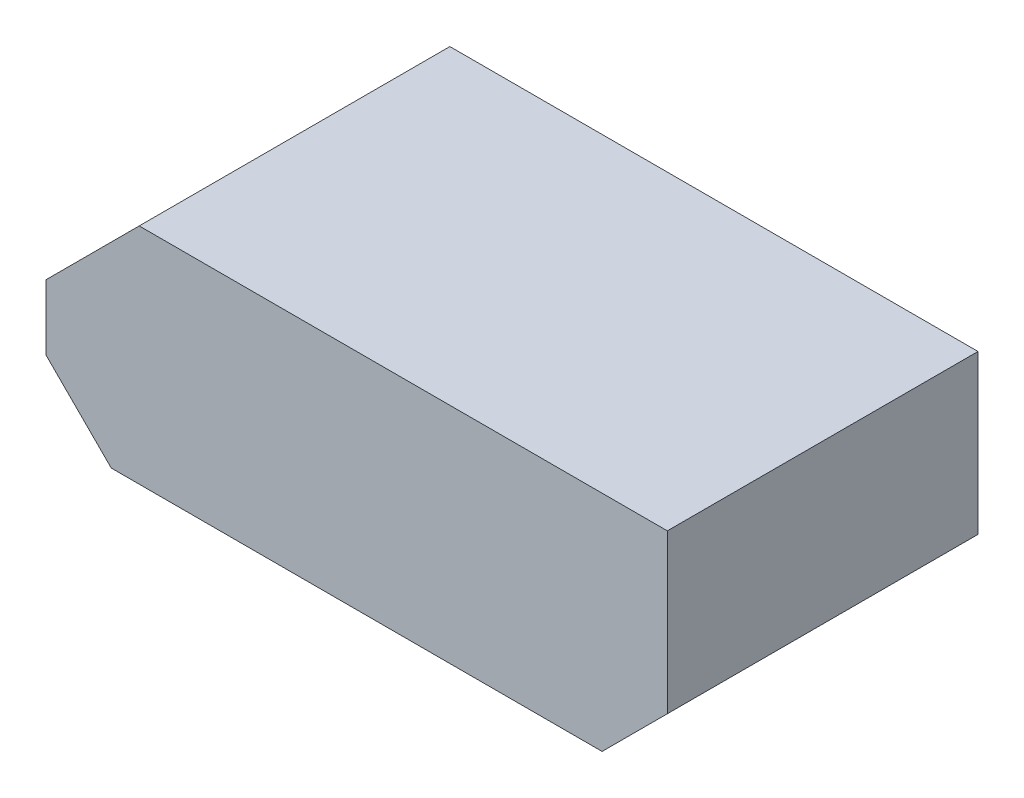
from build123d import *

# Parameters (mm, degrees)
BOSS_EXTRU_1_DEPTH = 500


with BuildPart() as part:
    # Esquisse1 → Boss.-Extru.1 (new body)
    with BuildSketch(Plane.XY):
        Polygon((404.882928221, 181.315844241), (254.882928221, 31.315844241), (254.882928221, -73.684155759), (359.882928221, -178.684155759), (1149.882928221, -178.684155759), (1254.882928221, -73.684155759), (1254.882928221, 181.315844241), align=None)
    extrude(amount=BOSS_EXTRU_1_DEPTH)


solid = part.part
